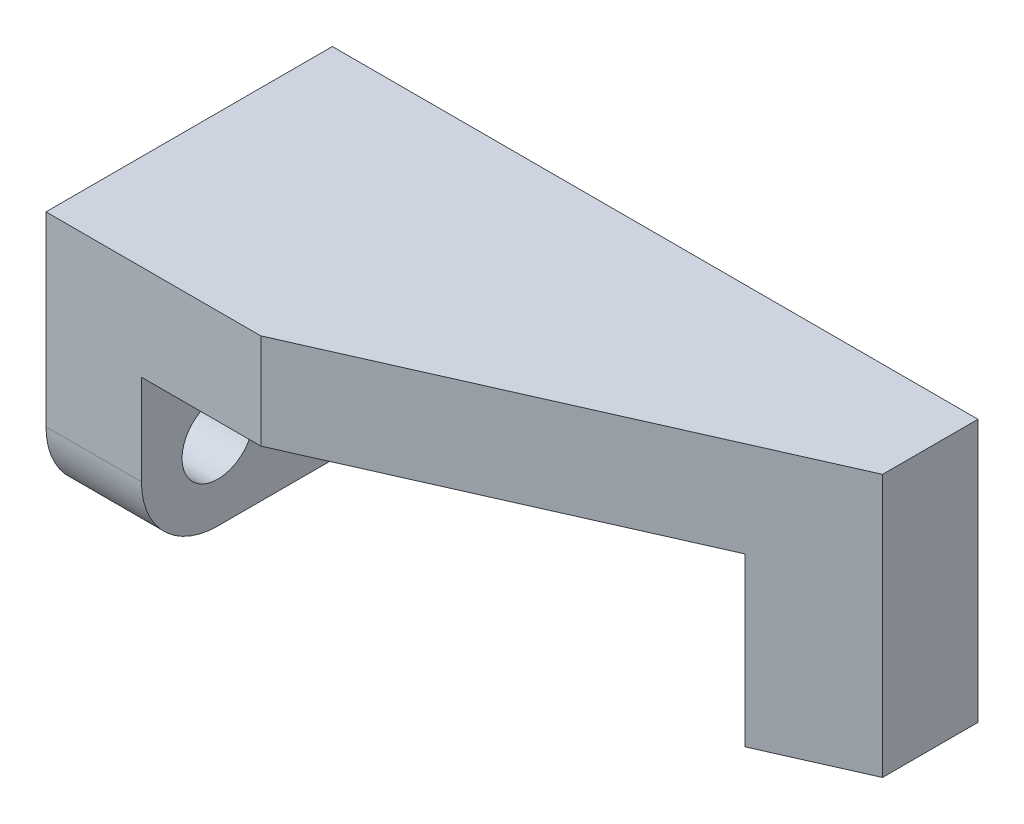
from build123d import *

# Parameters (mm, degrees)
BOSS_EXTRUDE3_DEPTH     = 60
CUT_EXTRUDE1_DEPTH      = 97.950548376
CUT_EXTRUDE1_DEPTH_BACK = 97.950548376
FILLET3_R               = 16
SKETCH7_R               = 7.5
CUT_EXTRUDE2_DEPTH      = 100


with BuildPart() as part:
    # Sketch3 → Boss-Extrude3 (new body)
    with BuildSketch(Plane.XY):
        Polygon((-47.6343761, -55), (-47.6343761, -20), (47.6343761, -20), (47.6343761, -55), (67.6343761, -55), (67.6343761, 0), (-67.6343761, 0), (-67.6343761, -55), align=None)
    extrude(amount=BOSS_EXTRUDE3_DEPTH)

    # Sketch4 → Cut-Extrude1 (cut, two sides: drawn at the far end of the back side and taken through both)
    with BuildSketch(Plane.XZ.offset(20).offset(-CUT_EXTRUDE1_DEPTH_BACK)):
        Polygon((-22.6343761, 60), (67.6343761, 60), (67.6343761, 20), align=None)
    extrude(amount=CUT_EXTRUDE1_DEPTH + CUT_EXTRUDE1_DEPTH_BACK, mode=Mode.SUBTRACT)

    # Fillet3
    fillet3_edges = [part.edges().sort_by_distance(p)[0] for p in [
        (-57.6343761, -55, 60),
    ]]
    fillet(fillet3_edges, radius=FILLET3_R)

    # Sketch7 → Cut-Extrude2 (cut)
    with BuildSketch(Plane(origin=(-47.6343761, 0, 0), x_dir=(0, 0, -1), z_dir=(1, 0, 0))):
        with Locations((-44, -39)):
            Circle(SKETCH7_R)
    extrude(amount=-CUT_EXTRUDE2_DEPTH, mode=Mode.SUBTRACT)


solid = part.part
